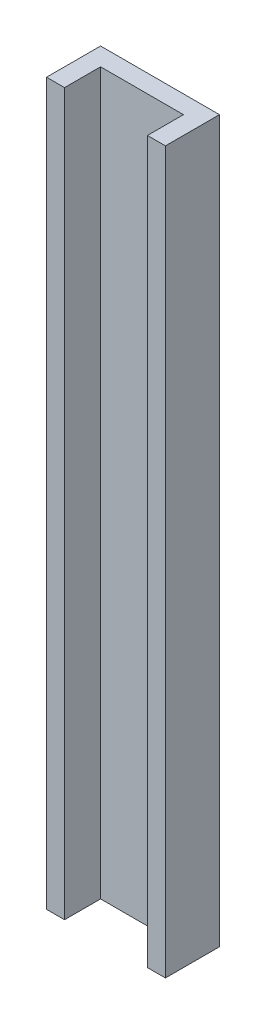
from build123d import *

# Parameters (mm, degrees)
SKETCH_1_W      = 33
SKETCH_1_H      = 200
EXTRUDE_1_DEPTH = 5
SKETCH_2_W      = 5
SKETCH_2_H      = 200
EXTRUDE_2_DEPTH = 10


with BuildPart() as part:
    # 草图1 → 凸台-拉伸1 (new body)
    with BuildSketch(Plane.XY):
        Rectangle(SKETCH_1_W, SKETCH_1_H)
    extrude(amount=EXTRUDE_1_DEPTH)

    # 草图2 → 凸台-拉伸2 (add)
    with BuildSketch(Plane.XY.offset(5)):
        with Locations((-14, 0)):
            Rectangle(SKETCH_2_W, SKETCH_2_H)
        with Locations((14, 0)):
            Rectangle(SKETCH_2_W, SKETCH_2_H)
    extrude(amount=EXTRUDE_2_DEPTH)


solid = part.part
